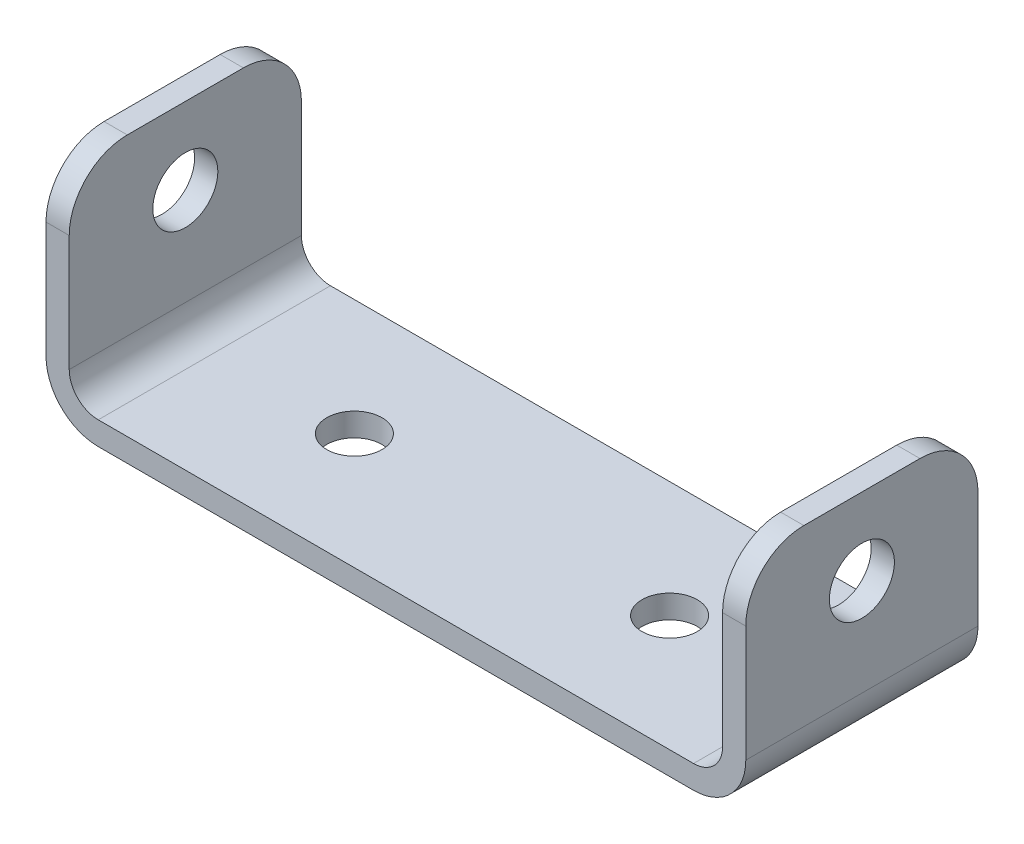
from build123d import *

# Parameters (mm, degrees)
EXTRUDE_THIN1_DEPTH = 25.4
SKETCH3_R           = 3.021976596
EXTRUDE2_DEPTH      = 82.338554141
SKETCH4_R           = 3.556
EXTRUDE3_DEPTH      = 81.534
FILLET1_R           = 6.35


with BuildPart() as part:
    # Sketch1 → Extrude-Thin1 (new body)
    with BuildSketch(Plane.XY):
        with BuildLine():
            Line((0, 22.225), (0, 3.175))
            ThreePointArc((0, 3.175), (0.92993597, 0.92993597), (3.175, 0))
            Line((3.175, 0), (68.290741431, 0))
            ThreePointArc((68.290741431, 0), (70.535805461, 0.92993597), (71.465741431, 3.175))
            Line((71.465741431, 3.175), (71.465741431, 22.225))
            Line((71.465741431, 22.225), (74.005741431, 22.225))
            Line((74.005741431, 22.225), (74.005741431, 3.175))
            ThreePointArc((74.005741431, 3.175), (72.331856686, -0.866115254), (68.290741431, -2.54))
            Line((68.290741431, -2.54), (3.175, -2.54))
            ThreePointArc((3.175, -2.54), (-0.866115254, -0.866115254), (-2.54, 3.175))
            Line((-2.54, 3.175), (-2.54, 22.225))
            Line((-2.54, 22.225), (0, 22.225))
        make_face()
    extrude(amount=EXTRUDE_THIN1_DEPTH)

    # Sketch3 → Extrude2 (cut, through all)
    with BuildSketch(Plane(origin=(0, 0, 0), x_dir=(1, 0, 0), z_dir=(0, 1, 0))):
        with Locations(Location((18.493278585, -12.7, 0), (0, 0, 270))):
            Circle(SKETCH3_R)
        with Locations(Location((52.972462846, -12.7, 0), (0, 0, 90))):
            Circle(SKETCH3_R)
    extrude(amount=-EXTRUDE2_DEPTH, mode=Mode.SUBTRACT)

    # Sketch4 → Extrude3 (cut, symmetric)
    with BuildSketch(Plane(origin=(0, 0, 0), x_dir=(0, 0, -1), z_dir=(1, 0, 0))):
        with Locations(Location((-12.7, 13.821871469, 0), (0, 0, 90))):
            Circle(SKETCH4_R)
    extrude(amount=EXTRUDE3_DEPTH, both=True, mode=Mode.SUBTRACT)

    # Fillet1
    fillet1_edges = [part.edges().sort_by_distance(p)[0] for p in [
        (-1.27, 22.225, 0),
        (72.735741431, 22.225, 0),
        (-1.27, 22.225, 25.4),
        (72.735741431, 22.225, 25.4),
    ]]
    fillet(fillet1_edges, radius=FILLET1_R)


solid = part.part
